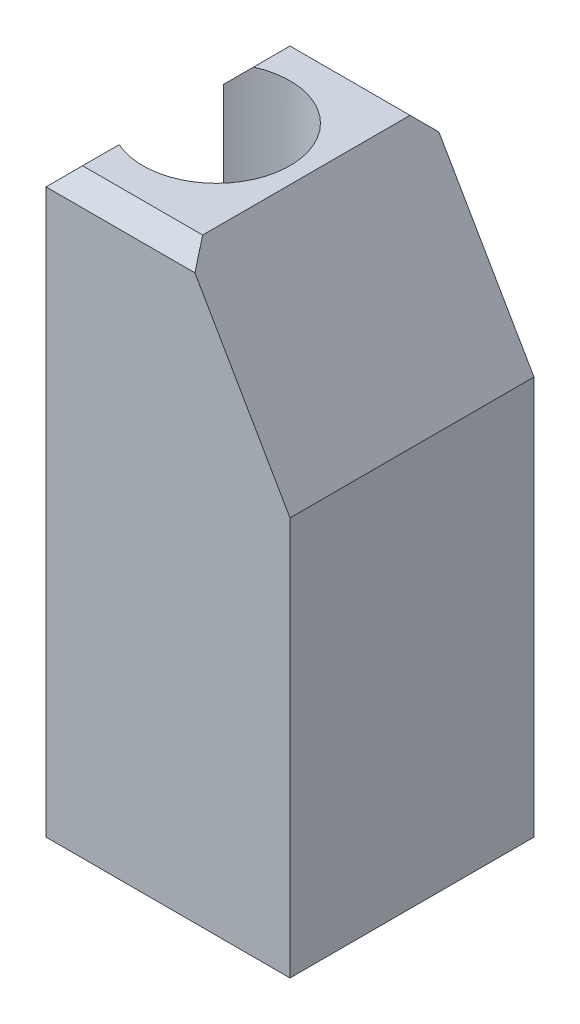
from build123d import *

# Parameters (mm, degrees)
SKETCH1_W           = 40
SKETCH1_H           = 40
BOSS_EXTRUDE1_DEPTH = 35.33
SKETCH2_R           = 12.07
CUT_EXTRUDE1_DEPTH  = 42
SKETCH3_W           = 40
SKETCH3_H           = 40
BOSS_EXTRUDE2_DEPTH = 60
CHAMFER1_SIZE       = 30
CHAMFER1_SIZE2      = 17.320508076
CHAMFER2_SIZE       = 3


with BuildPart() as part:
    # Sketch1 → Boss-Extrude1 (new body)
    with BuildSketch(Plane(origin=(0, 0, 0), x_dir=(1, 0, 0), z_dir=(0, 1, 0))):
        Rectangle(SKETCH1_W, SKETCH1_H)
    extrude(amount=BOSS_EXTRUDE1_DEPTH)

    # Sketch2 → Cut-Extrude1 (cut)
    with BuildSketch(Plane(origin=(0, 35.33, 0), x_dir=(1, 0, 0), z_dir=(0, 1, 0))):
        with Locations((-12.07, 0)):
            Circle(SKETCH2_R)
    extrude(amount=-CUT_EXTRUDE1_DEPTH, mode=Mode.SUBTRACT)

    # Sketch3 → Boss-Extrude2 (add)
    with BuildSketch(Plane.XZ):
        Rectangle(SKETCH3_W, SKETCH3_H)
    extrude(amount=BOSS_EXTRUDE2_DEPTH)

    # Chamfer1
    chamfer1_edges = [part.edges().sort_by_distance(p)[0] for p in [
        (20, 35.33, 0),
    ]]
    chamfer1_side = [part.faces().sort_by_distance(p)[0] for p in [
        (20, -12.335, 0),
    ]]
    chamfer(chamfer1_edges, length=CHAMFER1_SIZE, length2=CHAMFER1_SIZE2, reference=chamfer1_side[0])

    # Chamfer2
    chamfer2_edges = [part.edges().sort_by_distance(p)[0] for p in [
        (-20, 35.33, -14.549725266),
        (-20, 35.33, 14.549725266),
        (-8.660254038, 35.33, 20),
        (-8.660254038, 35.33, -20),
    ]]
    chamfer(chamfer2_edges, length=CHAMFER2_SIZE)


solid = part.part
